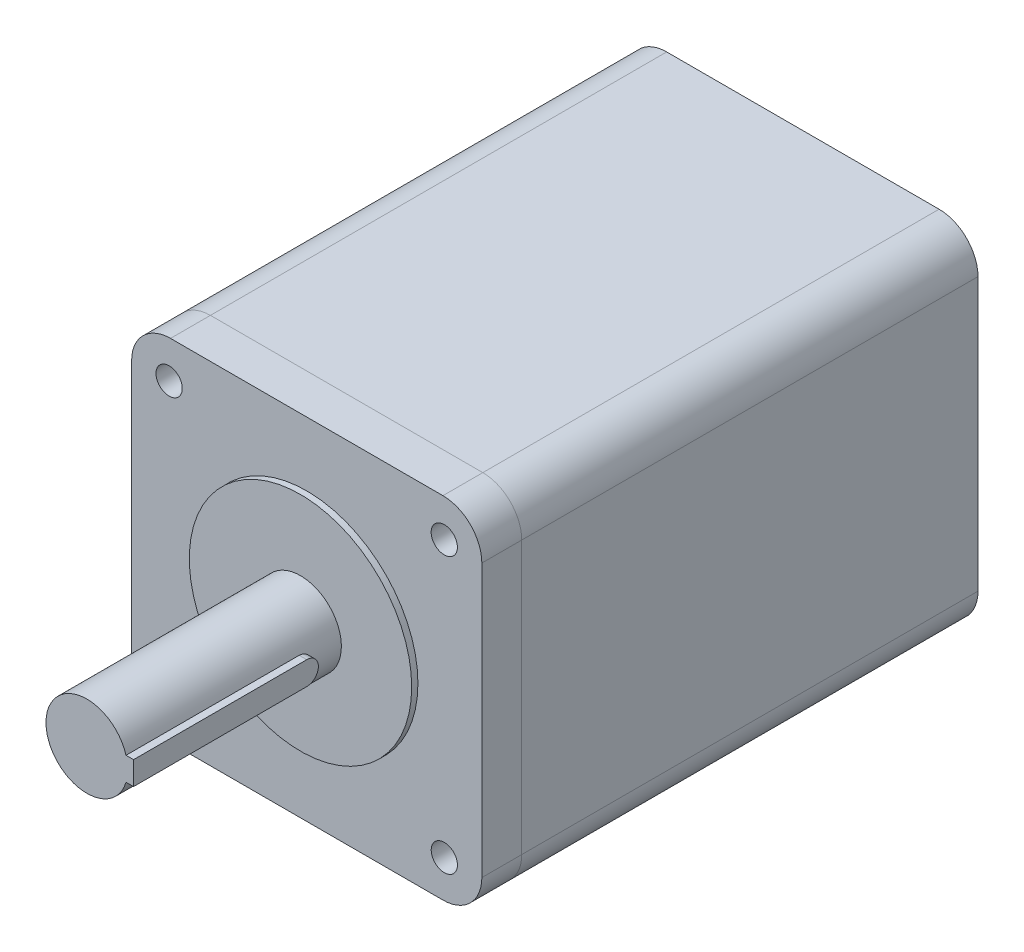
from build123d import *

# Parameters (mm, degrees)
EXTRUDE_1_DEPTH      = 20.5
CUT_EXTRUDE_1_REACH  = 130.92
SKETCH_2_R           = 6.75
EXTRUDE_2_DEPTH      = 234.5
SKETCH_4_R           = 57.15
EXTRUDE_3_DEPTH      = 3.2
SKETCH_5_R           = 21
EXTRUDE_4_DEPTH      = 109.8
SKETCH_6_W           = 8
SKETCH_6_H           = 12
EXTRUDE_5_DEPTH      = 89
EXTRUDE_6_REACH      = 277.837
EXTRUDE_6_END_RADIUS = 21


with BuildPart() as part:
    # 草图1 → 凸台-拉伸1 (new body)
    with BuildSketch(Plane.XY):
        with BuildLine():
            Line((-70, -90), (70, -90))
            ThreePointArc((70, -90), (84.142135624, -84.142135624), (90, -70))
            Line((90, -70), (90, 70))
            ThreePointArc((90, 70), (84.142135624, 84.142135624), (70, 90))
            Line((70, 90), (-70, 90))
            ThreePointArc((-70, 90), (-84.142135624, 84.142135624), (-90, 70))
            Line((-90, 70), (-90, -70))
            ThreePointArc((-90, -70), (-84.142135624, -84.142135624), (-70, -90))
        make_face()
    extrude(amount=EXTRUDE_1_DEPTH)

    # 草图2 → 切除-拉伸1 (cut, up to next)
    with BuildSketch(Plane.XY.offset(20.5), mode=Mode.PRIVATE) as cut_extrude_1_sk1:
        with Locations((-70.72748515, 70.693867092)):
            Circle(SKETCH_2_R)
    cut_extrude_1_tool1 = extrude(cut_extrude_1_sk1.sketch, amount=-CUT_EXTRUDE_1_REACH, mode=Mode.PRIVATE) & part.part
    # 草图2 → 切除-拉伸1 (cut, up to next)
    with BuildSketch(Plane.XY.offset(20.5), mode=Mode.PRIVATE) as cut_extrude_1_sk2:
        with Locations((70.693867092, 70.72748515)):
            Circle(SKETCH_2_R)
    cut_extrude_1_tool2 = extrude(cut_extrude_1_sk2.sketch, amount=-CUT_EXTRUDE_1_REACH, mode=Mode.PRIVATE) & part.part
    # 草图2 → 切除-拉伸1 (cut, up to next)
    with BuildSketch(Plane.XY.offset(20.5), mode=Mode.PRIVATE) as cut_extrude_1_sk3:
        with Locations((70.72748515, -70.693867092)):
            Circle(SKETCH_2_R)
    cut_extrude_1_tool3 = extrude(cut_extrude_1_sk3.sketch, amount=-CUT_EXTRUDE_1_REACH, mode=Mode.PRIVATE) & part.part
    # 草图2 → 切除-拉伸1 (cut, up to next)
    with BuildSketch(Plane.XY.offset(20.5), mode=Mode.PRIVATE) as cut_extrude_1_sk4:
        with Locations((-70.693867092, -70.72748515)):
            Circle(SKETCH_2_R)
    cut_extrude_1_tool4 = extrude(cut_extrude_1_sk4.sketch, amount=-CUT_EXTRUDE_1_REACH, mode=Mode.PRIVATE) & part.part
    add(cut_extrude_1_tool1.solids().sort_by_distance((-70.727485, 70.693867, 20.5))[0], mode=Mode.SUBTRACT)
    add(cut_extrude_1_tool2.solids().sort_by_distance((70.693867, 70.727485, 20.5))[0], mode=Mode.SUBTRACT)
    add(cut_extrude_1_tool3.solids().sort_by_distance((70.727485, -70.693867, 20.5))[0], mode=Mode.SUBTRACT)
    add(cut_extrude_1_tool4.solids().sort_by_distance((-70.693867, -70.727485, 20.5))[0], mode=Mode.SUBTRACT)

    # 草图4 → 凸台-拉伸3 (add)
    with BuildSketch(Plane.XY.offset(20.5)):
        Circle(SKETCH_4_R)
    extrude(amount=EXTRUDE_3_DEPTH)

    # 草图5 → 凸台-拉伸4 (add)
    with BuildSketch(Plane.XY.offset(23.7)):
        Circle(SKETCH_5_R)
    extrude(amount=EXTRUDE_4_DEPTH)

    # 草图6 → 凸台-拉伸5 (add)
    with BuildSketch(Plane.XY.offset(133.5)):
        with Locations((20, 0)):
            Rectangle(SKETCH_6_W, SKETCH_6_H)
    extrude(amount=-EXTRUDE_5_DEPTH)

    # 凸台-拉伸6: up to this cylinder (the profile starts outside it)
    extrude_6_end = Plane(origin=(0, 0, 41.953521), z_dir=(0, 0, -1)) * Cylinder(EXTRUDE_6_END_RADIUS, 598.674, mode=Mode.PRIVATE)
    # 草图7 → 凸台-拉伸6 (add, up to the surface)
    with BuildSketch(Plane(origin=(24, 0, 0), x_dir=(0, 0, -1), z_dir=(1, 0, 0)), mode=Mode.PRIVATE) as extrude_6_sk1:
        with BuildLine():
            Line((-44.5, -6), (-44.5, 6))
            ThreePointArc((-44.5, 6), (-38.5, 0), (-44.5, -6))
        make_face()
    extrude_6_tool1 = extrude(extrude_6_sk1.sketch, amount=-EXTRUDE_6_REACH, mode=Mode.PRIVATE) - extrude_6_end
    add(extrude_6_tool1.solids().sort_by_distance((24, 0, 41.953521))[0])


with BuildPart() as body_2:
    # 草图3 → 凸台-拉伸2 (new body)
    with BuildSketch(Plane(origin=(0, 0, 0), x_dir=(-1, 0, 0), z_dir=(0, 0, -1))):
        with BuildLine():
            Line((-70, -90), (70, -90))
            ThreePointArc((70, -90), (84.142135624, -84.142135624), (90, -70))
            Line((90, -70), (90, 70))
            ThreePointArc((90, 70), (84.142135624, 84.142135624), (70, 90))
            Line((70, 90), (-70, 90))
            ThreePointArc((-70, 90), (-84.142135624, 84.142135624), (-90, 70))
            Line((-90, 70), (-90, -70))
            ThreePointArc((-90, -70), (-84.142135624, -84.142135624), (-70, -90))
        make_face()
    extrude(amount=EXTRUDE_2_DEPTH)


solid = Compound([part.part, body_2.part])
